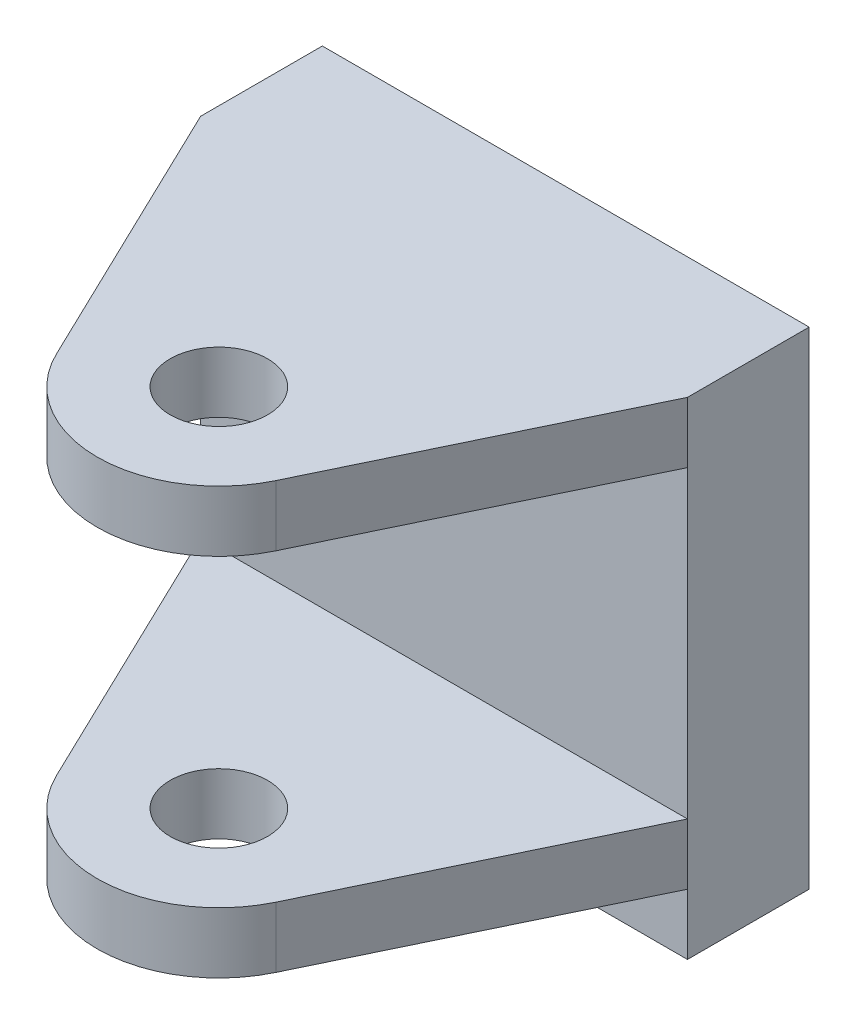
from build123d import *

# Parameters (mm, degrees)
SKETCH_1_W             = 40
SKETCH_1_H             = 40
EXTRUDE_1_DEPTH        = 10
SKETCH_2_R             = 10
SKETCH_2_R_2           = 4
EXTRUDE_2_DEPTH        = 5
PATTERN_LINEAR_1_COUNT = 2
PATTERN_LINEAR_1_PITCH = 30


with BuildPart() as part:
    # 草图1 → 凸台-拉伸1 (new body)
    with BuildSketch(Plane.XY):
        Rectangle(SKETCH_1_W, SKETCH_1_H)
    extrude(amount=EXTRUDE_1_DEPTH)

    # 草图2 → 凸台-拉伸2 (add)
    # profile 1 of 2: a face of its own
    with BuildSketch(Plane(origin=(0, 15, 0), x_dir=(1, 0, 0), z_dir=(0, 1, 0))):
        with BuildLine():
            Line((20, -10), (-20, -10))
            Line((-20, -10), (-9.01096744, -32.836181016))
            ThreePointArc((-9.01096744, -32.836181016), (-2.223772201, -18.750392972), (10, -28.5))
            ThreePointArc((10, -28.5), (9.749607028, -30.723772201), (9.01096744, -32.836181016))
            Line((9.01096744, -32.836181016), (20, -10))
        make_face()
    # profile 2 of 2: a face of its own
    with BuildSketch(Plane(origin=(0, 15, 0), x_dir=(1, 0, 0), z_dir=(0, 1, 0))):
        with Locations((0, -28.5)):
            Circle(SKETCH_2_R)
        with Locations(Location((0, -28.5, 0), (0, 0, 270))):
            Circle(SKETCH_2_R_2, mode=Mode.SUBTRACT)
    extrude_2 = extrude(amount=EXTRUDE_2_DEPTH)

    # 阵列(线性)1: 凸台-拉伸2 ×2
    with Locations(*[(0, -i * PATTERN_LINEAR_1_PITCH, 0) for i in range(1, PATTERN_LINEAR_1_COUNT)]):
        add(extrude_2)


solid = part.part
